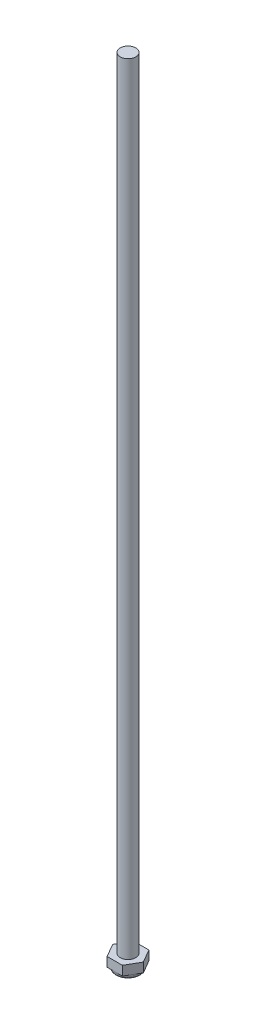
from build123d import *

# Parameters (mm, degrees)
SALIENTE_EXTRUIR1_DEPTH = 6
CROQUIS2_R              = 8.1
SALIENTE_EXTRUIR2_DEPTH = 3
REDONDEO1_R             = 2
CROQUIS3_R              = 5
SALIENTE_EXTRUIR3_DEPTH = 500


with BuildPart() as part:
    # Croquis1 → Saliente-Extruir1 (new body)
    with BuildSketch(Plane(origin=(0, 0, 0), x_dir=(1, 0, 0), z_dir=(0, 1, 0))):
        Polygon((4.907477288, -8.5), (9.814954576, 0), (4.907477288, 8.5), (-4.907477288, 8.5), (-9.814954576, 0), (-4.907477288, -8.5), align=None)
    extrude(amount=SALIENTE_EXTRUIR1_DEPTH)

    # Croquis2 → Saliente-Extruir2 (add)
    with BuildSketch(Plane.XZ):
        with Locations(Location((0, 0, 0), (0, 0, 270))):
            Circle(CROQUIS2_R)
    extrude(amount=SALIENTE_EXTRUIR2_DEPTH)

    # Redondeo1
    redondeo1_edges = [part.edges().sort_by_distance(p)[0] for p in [
        (0, -3, 8.1),
    ]]
    fillet(redondeo1_edges, radius=REDONDEO1_R)

    # Croquis3 → Saliente-Extruir3 (add)
    with BuildSketch(Plane(origin=(0, 6, 0), x_dir=(1, 0, 0), z_dir=(0, 1, 0))):
        with Locations(Location((0, 0, 0), (0, 0, 270))):
            Circle(CROQUIS3_R)
    extrude(amount=SALIENTE_EXTRUIR3_DEPTH)


solid = part.part
